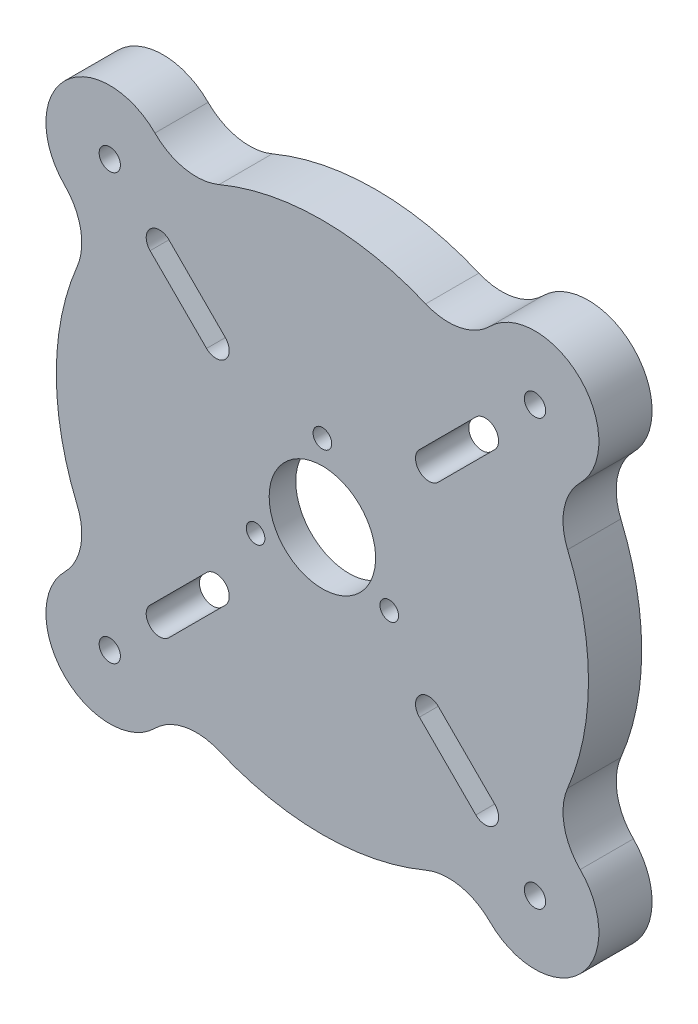
from build123d import *

# Parameters (mm, degrees)
SKETCH2_R           = 2
BOSS_EXTRUDE2_DEPTH = 10
SKETCH3_R           = 21.25
CUT_EXTRUDE2_DEPTH  = 5
SKETCH3_3_R         = 1.75
CUT_EXTRUDE3_DEPTH  = 75.1479844
SKETCH4_R           = 10
CUT_EXTRUDE4_DEPTH  = 74.640502379


with BuildPart() as part:
    # Sketch2 → Boss-Extrude2 (new body)
    with BuildSketch(Plane.XY):
        with BuildLine():
            ThreePointArc((46.077281732, -19.413503243), (50, 0), (46.077281732, 19.413503243))
            ThreePointArc((46.077281732, 19.413503243), (45.41900176, 25.799706685), (48.436814511, 31.466251763))
            ThreePointArc((48.436814511, 31.466251763), (48.436814511, 48.436814511), (31.466251763, 48.436814511))
            ThreePointArc((31.466251763, 48.436814511), (25.799706685, 45.41900176), (19.413503243, 46.077281732))
            ThreePointArc((19.413503243, 46.077281732), (0, 50), (-19.413503243, 46.077281732))
            ThreePointArc((-19.413503243, 46.077281732), (-25.799706685, 45.41900176), (-31.466251763, 48.436814511))
            ThreePointArc((-31.466251763, 48.436814511), (-48.436814511, 48.436814511), (-48.436814511, 31.466251763))
            ThreePointArc((-48.436814511, 31.466251763), (-45.41900176, 25.799706685), (-46.077281732, 19.413503243))
            ThreePointArc((-46.077281732, 19.413503243), (-50, 0), (-46.077281732, -19.413503243))
            ThreePointArc((-46.077281732, -19.413503243), (-45.41900176, -25.799706685), (-48.436814511, -31.466251763))
            ThreePointArc((-48.436814511, -31.466251763), (-48.436814511, -48.436814511), (-31.466251763, -48.436814511))
            ThreePointArc((-31.466251763, -48.436814511), (-25.799706685, -45.41900176), (-19.413503243, -46.077281732))
            ThreePointArc((-19.413503243, -46.077281732), (0, -50), (19.413503243, -46.077281732))
            ThreePointArc((19.413503243, -46.077281732), (25.799706685, -45.41900176), (31.466251763, -48.436814511))
            ThreePointArc((31.466251763, -48.436814511), (48.436814511, -48.436814511), (48.436814511, -31.466251763))
            ThreePointArc((48.436814511, -31.466251763), (45.41900176, -25.799706685), (46.077281732, -19.413503243))
        make_face()
        with BuildLine():
            ThreePointArc((-21.767766953, -18.232233047), (-18.232233047, -18.232233047), (-18.232233047, -21.767766953))
            Line((-18.232233047, -21.767766953), (-28.838834765, -32.374368671))
            ThreePointArc((-28.838834765, -32.374368671), (-32.374368671, -32.374368671), (-32.374368671, -28.838834765))
            Line((-32.374368671, -28.838834765), (-21.767766953, -18.232233047))
        make_face(mode=Mode.SUBTRACT)
        with BuildLine():
            ThreePointArc((18.232233047, -21.767766953), (18.232233047, -18.232233047), (21.767766953, -18.232233047))
            Line((21.767766953, -18.232233047), (32.374368671, -28.838834765))
            ThreePointArc((32.374368671, -28.838834765), (32.374368671, -32.374368671), (28.838834765, -32.374368671))
            Line((28.838834765, -32.374368671), (18.232233047, -21.767766953))
        make_face(mode=Mode.SUBTRACT)
        with BuildLine():
            ThreePointArc((-18.232233047, 21.767766953), (-18.232233047, 18.232233047), (-21.767766953, 18.232233047))
            Line((-21.767766953, 18.232233047), (-32.374368671, 28.838834765))
            ThreePointArc((-32.374368671, 28.838834765), (-32.374368671, 32.374368671), (-28.838834765, 32.374368671))
            Line((-28.838834765, 32.374368671), (-18.232233047, 21.767766953))
        make_face(mode=Mode.SUBTRACT)
        with BuildLine():
            ThreePointArc((21.767766953, 18.232233047), (18.232233047, 18.232233047), (18.232233047, 21.767766953))
            Line((18.232233047, 21.767766953), (28.838834765, 32.374368671))
            ThreePointArc((28.838834765, 32.374368671), (32.374368671, 32.374368671), (32.374368671, 28.838834765))
            Line((32.374368671, 28.838834765), (21.767766953, 18.232233047))
        make_face(mode=Mode.SUBTRACT)
        with Locations((39.951533137, -39.951533137)):
            Circle(SKETCH2_R, mode=Mode.SUBTRACT)
        with Locations((-39.951533137, -39.951533137)):
            Circle(SKETCH2_R, mode=Mode.SUBTRACT)
        with Locations((-39.951533137, 39.951533137)):
            Circle(SKETCH2_R, mode=Mode.SUBTRACT)
        with Locations((39.951533137, 39.951533137)):
            Circle(SKETCH2_R, mode=Mode.SUBTRACT)
    extrude(amount=BOSS_EXTRUDE2_DEPTH)

    # Sketch3 → Cut-Extrude2 (cut)
    with BuildSketch(Plane(origin=(0, 0, 0), x_dir=(-1, 0, 0), z_dir=(0, 0, -1))):
        Circle(SKETCH3_R)
    extrude(amount=-CUT_EXTRUDE2_DEPTH, mode=Mode.SUBTRACT)

    # Sketch3<3> → Cut-Extrude3 (cut, through all)
    with BuildSketch(Plane(origin=(0, 0, 0), x_dir=(-1, 0, 0), z_dir=(0, 0, -1))):
        with Locations((0, 14.5)):
            Circle(SKETCH3_3_R)
        with Locations((12.557368355, -7.25)):
            Circle(SKETCH3_3_R)
        with Locations((-12.557368355, -7.25)):
            Circle(SKETCH3_3_R)
    extrude(amount=-CUT_EXTRUDE3_DEPTH, mode=Mode.SUBTRACT)

    # Sketch4 → Cut-Extrude4 (cut, through all)
    with BuildSketch(Plane(origin=(0, 0, 5), x_dir=(-1, 0, 0), z_dir=(0, 0, -1))):
        Circle(SKETCH4_R)
    extrude(amount=-CUT_EXTRUDE4_DEPTH, mode=Mode.SUBTRACT)


solid = part.part
